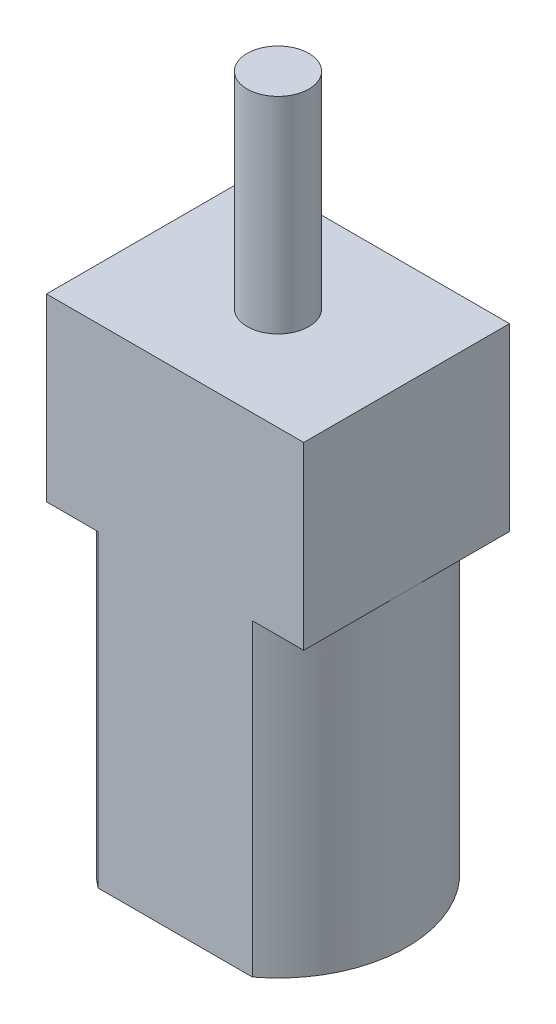
from build123d import *

# Parameters (mm, degrees)
SKETCH1_R           = 6.35
BOSS_EXTRUDE1_DEPTH = 15.24
SKETCH3_W           = 12.7
SKETCH3_H           = 10.16
BOSS_EXTRUDE2_DEPTH = 8.89
CUT_EXTRUDE2_DEPTH  = 26.746881365
SKETCH5_R           = 1.524
BOSS_EXTRUDE3_DEPTH = 10.16


with BuildPart() as part:
    # Sketch1 → Boss-Extrude1 (new body)
    with BuildSketch(Plane(origin=(0, 0, 0), x_dir=(1, 0, 0), z_dir=(0, 1, 0))):
        with Locations(Location((0, 0, 0), (0, 0, 90))):
            Circle(SKETCH1_R)
    extrude(amount=BOSS_EXTRUDE1_DEPTH)

    # Sketch3 → Boss-Extrude2 (add)
    with BuildSketch(Plane(origin=(0, 15.24, 0), x_dir=(1, 0, 0), z_dir=(0, 1, 0))):
        Rectangle(SKETCH3_W, SKETCH3_H)
    extrude(amount=BOSS_EXTRUDE2_DEPTH)

    # Sketch4 → Cut-Extrude2 (cut, through all)
    with BuildSketch(Plane(origin=(0, 24.13, 0), x_dir=(1, 0, 0), z_dir=(0, 1, 0))):
        with BuildLine():
            ThreePointArc((3.81, 5.08), (0, 6.35), (-3.81, 5.08))
            Line((-3.81, 5.08), (3.81, 5.08))
        make_face()
        with BuildLine():
            Line((3.81, -5.08), (-3.81, -5.08))
            ThreePointArc((-3.81, -5.08), (0, -6.35), (3.81, -5.08))
        make_face()
    extrude(amount=-CUT_EXTRUDE2_DEPTH, mode=Mode.SUBTRACT)

    # Sketch5 → Boss-Extrude3 (add)
    with BuildSketch(Plane(origin=(0, 24.13, 0), x_dir=(1, 0, 0), z_dir=(0, 1, 0))):
        with Locations(Location((0, 0, 0), (0, 0, 270))):
            Circle(SKETCH5_R)
    extrude(amount=BOSS_EXTRUDE3_DEPTH)


solid = part.part
